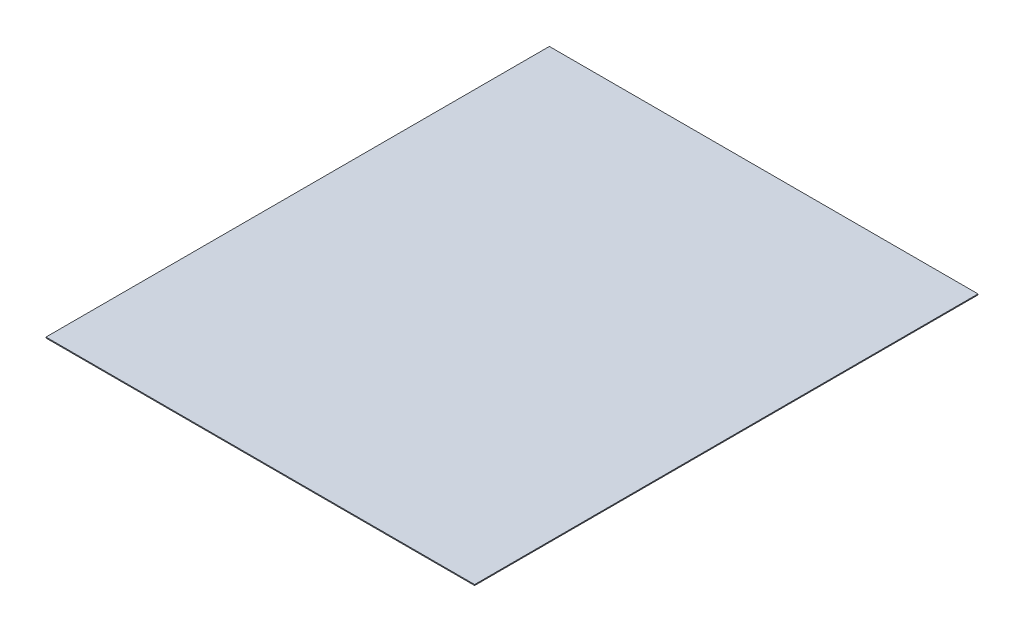
from build123d import *

# Parameters (mm, degrees)
SKETCH1_W               = 697
SKETCH1_H               = 1.5
TOPPING_DIS_ALT_1_DEPTH = 818.5


with BuildPart() as part:
    # Sketch1 → TOPPING_dis_alt_1 (new body)
    with BuildSketch(Plane.XY):
        with Locations((350, 200.75)):
            Rectangle(SKETCH1_W, SKETCH1_H)
    extrude(amount=-TOPPING_DIS_ALT_1_DEPTH)


solid = part.part
